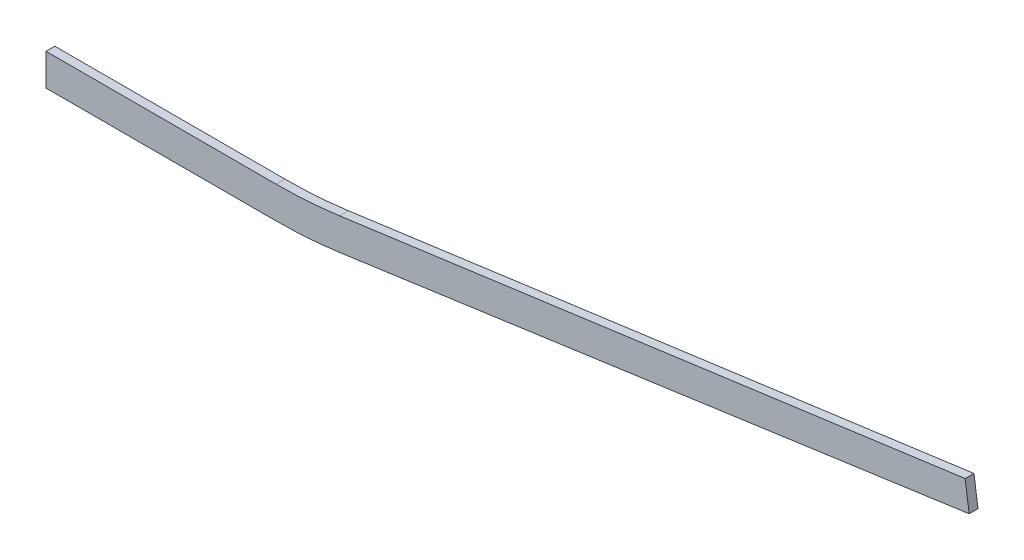
from build123d import *

# Parameters (mm, degrees)
BOSS_EXTRUDE1_DEPTH = 9.525


with BuildPart() as part:
    # Sketch1 → Boss-Extrude1 (new body)
    with BuildSketch(Plane.XY):
        with BuildLine():
            Line((3698.447784852, 2129.443490028), (3698.447784852, 2163.833257171))
            Line((3698.447784852, 2163.833257171), (3946.558415395, 2163.833257171))
            ThreePointArc((3946.558415395, 2163.833257171), (3980.94374292, 2164.998324228), (4015.171349136, 2168.48818138))
            Line((4015.171349136, 2168.48818138), (4690.071288545, 2260.486428809))
            Line((4690.071288545, 2260.486428809), (4694.397784852, 2229.701807984))
            Line((4694.397784852, 2229.701807984), (4016.199899672, 2134.387311107))
            ThreePointArc((4016.199899672, 2134.387311107), (3980.936253046, 2130.680952496), (3945.499964384, 2129.443490028))
            Line((3945.499964384, 2129.443490028), (3698.447784852, 2129.443490028))
        make_face()
    extrude(amount=BOSS_EXTRUDE1_DEPTH)


solid = part.part
